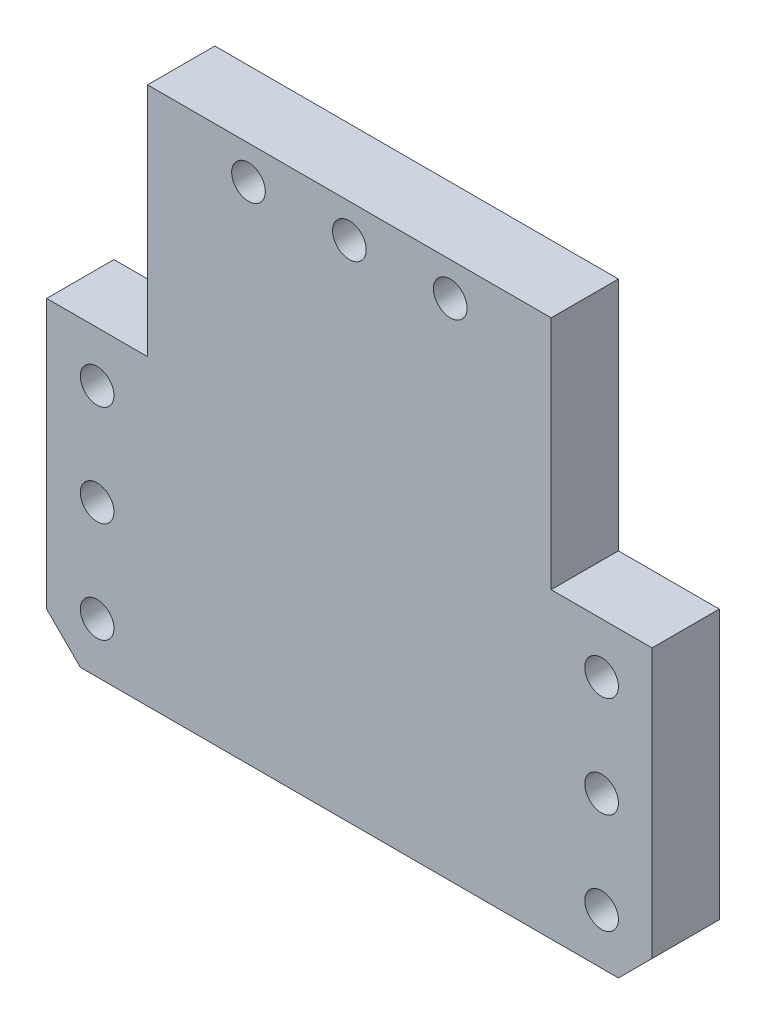
from build123d import *

# Parameters (mm, degrees)
ESQUISSE1_W             = 60
ESQUISSE1_H             = 80
BOSS_EXTRU_1_DEPTH      = 10
ESQUISSE3_W             = 15
ESQUISSE3_H             = 45
BOSS_EXTRU_2_DEPTH      = 10
ESQUISSE2_R             = 2.5
ENL_V_MAT_EXTRU_1_DEPTH = 10
CHANFREIN1_SIZE         = 5


with BuildPart() as part:
    # Esquisse1 → Boss.-Extru.1 (new body)
    with BuildSketch(Plane.XY):
        with Locations((30, 40)):
            Rectangle(ESQUISSE1_W, ESQUISSE1_H)
    extrude(amount=BOSS_EXTRU_1_DEPTH)

    # Esquisse3 → Boss.-Extru.2 (add)
    with BuildSketch(Plane.XY.offset(10)):
        with Locations((-7.5, 22.5)):
            Rectangle(ESQUISSE3_W, ESQUISSE3_H)
        with Locations((67.5, 22.5)):
            Rectangle(ESQUISSE3_W, ESQUISSE3_H)
    extrude(amount=-BOSS_EXTRU_2_DEPTH)

    # Esquisse2 → Enlèv. mat.-Extru.1 (cut)
    with BuildSketch(Plane.XY.offset(10)):
        with Locations((45, 75)):
            Circle(ESQUISSE2_R)
        with Locations((30, 75)):
            Circle(ESQUISSE2_R)
        with Locations(Location((15, 75, 0), (0, 0, 180))):
            Circle(ESQUISSE2_R)
        with Locations((-7.5, 22.5)):
            Circle(ESQUISSE2_R)
        with Locations((-7.5, 37.5)):
            Circle(ESQUISSE2_R)
        with Locations(Location((-7.5, 7.5, 0), (0, 0, 180))):
            Circle(ESQUISSE2_R)
        with Locations((67.5, 7.5)):
            Circle(ESQUISSE2_R)
        with Locations(Location((67.5, 37.5, 0), (0, 0, 180))):
            Circle(ESQUISSE2_R)
        with Locations(Location((67.5, 22.5, 0), (0, 0, 180))):
            Circle(ESQUISSE2_R)
    extrude(amount=-ENL_V_MAT_EXTRU_1_DEPTH, mode=Mode.SUBTRACT)

    # Chanfrein1
    chanfrein1_edges = [part.edges().sort_by_distance(p)[0] for p in [
        (-15, 0, 5),
        (75, 0, 5),
    ]]
    chamfer(chanfrein1_edges, length=CHANFREIN1_SIZE)


solid = part.part
